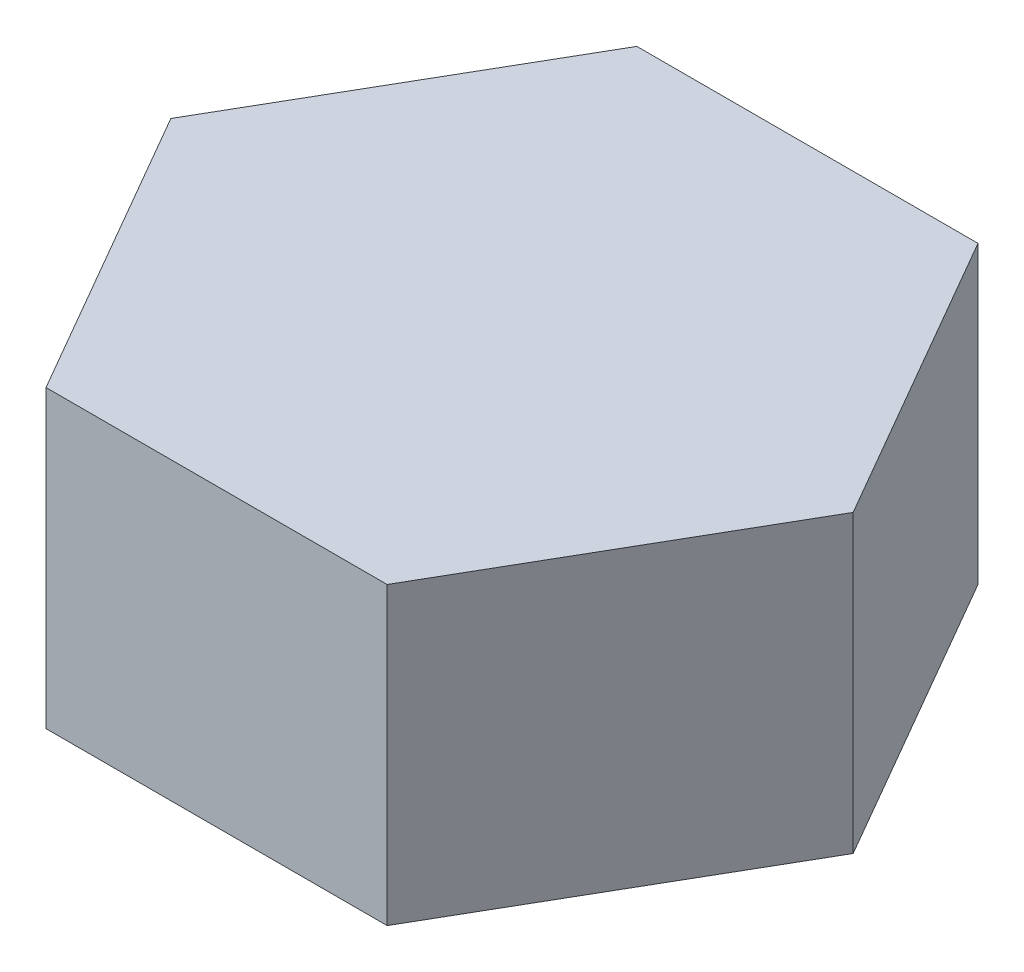
from build123d import *

# Parameters (mm, degrees)
EXTRUDE_1_DEPTH      = 150
EXTRUDE_1_DEPTH_BACK = 50


with BuildPart() as part:
    # 草图1 → 凸台-拉伸1 (new, two sides: drawn at the far end of the back side and taken through both)
    with BuildSketch(Plane(origin=(0, 0, 0), x_dir=(1, 0, 0), z_dir=(0, 1, 0)).offset(-EXTRUDE_1_DEPTH_BACK)):
        Polygon((230.940107676, 0), (115.470053838, 200), (-115.470053838, 200), (-230.940107676, 0), (-115.470053838, -200), (115.470053838, -200), align=None)
    extrude(amount=EXTRUDE_1_DEPTH + EXTRUDE_1_DEPTH_BACK)


solid = part.part
